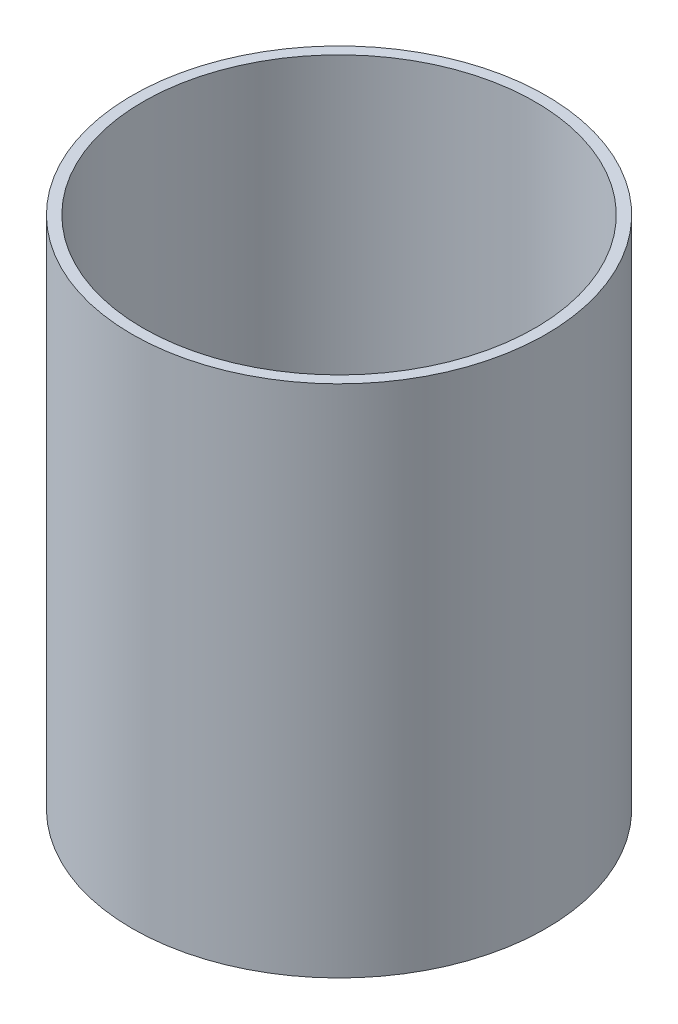
from build123d import *

# Parameters (mm, degrees)
CROQUIS1_R              = 60.325
CROQUIS1_R_2            = 57.15
SALIENTE_EXTRUIR1_DEPTH = 150


with BuildPart() as part:
    # Croquis1 → Saliente-Extruir1 (new body)
    with BuildSketch(Plane(origin=(0, 0, 0), x_dir=(1, 0, 0), z_dir=(0, 1, 0))):
        with Locations(Location((0, 0, 0), (0, 0, 270))):
            Circle(CROQUIS1_R)
        with Locations(Location((0, 0, 0), (0, 0, 270))):
            Circle(CROQUIS1_R_2, mode=Mode.SUBTRACT)
    extrude(amount=SALIENTE_EXTRUIR1_DEPTH)


solid = part.part
